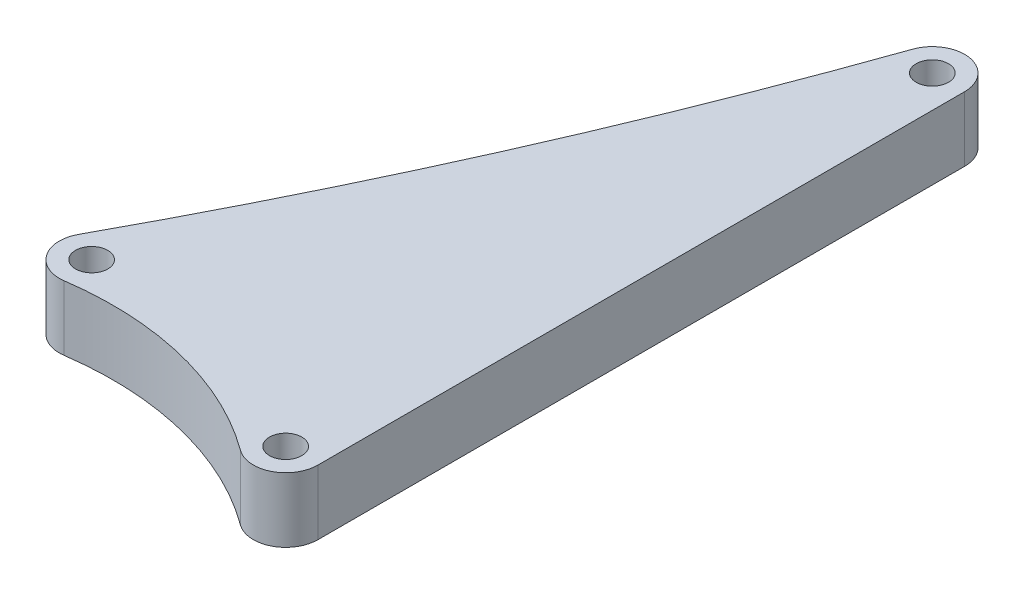
from build123d import *

# Parameters (mm, degrees)
SKETCH1_R           = 2.5
SKETCH1_R_2         = 1.25
BOSS_EXTRUDE1_DEPTH = 5


with BuildPart() as part:
    # Sketch1 → Boss-Extrude1 (new body)
    # profile 1 of 4: a face of its own
    with BuildSketch(Plane(origin=(0, 0, 0), x_dir=(1, 0, 0), z_dir=(0, 1, 0))):
        with Locations((0, -5)):
            Circle(SKETCH1_R)
        with Locations(Location((0, -5, 0), (0, 0, 270))):
            Circle(SKETCH1_R_2, mode=Mode.SUBTRACT)
    # profile 2 of 4: a face of its own
    with BuildSketch(Plane(origin=(0, 0, 0), x_dir=(1, 0, 0), z_dir=(0, 1, 0))):
        with BuildLine():
            Line((22.5, -10), (22.5, 40))
            ThreePointArc((22.5, 40), (19.579674257, 37.535588048), (17.641338984, 40.828684628))
            ThreePointArc((17.641338984, 40.828684628), (8.619996831, 18.113334742), (-2.195652157, -3.80454544))
            ThreePointArc((-2.195652157, -3.80454544), (0.616793972, -2.577281445), (2.5, -5))
            ThreePointArc((2.5, -5), (1.888934091, -6.637659305), (0.354457601, -7.474744393))
            ThreePointArc((0.354457601, -7.474744393), (9.883853248, -7.964587007), (18.522657697, -12.016794417))
            ThreePointArc((18.522657697, -12.016794417), (18.869370918, -7.770274035), (22.5, -10))
        make_face()
    # profile 3 of 4: a face of its own
    with BuildSketch(Plane(origin=(0, 0, 0), x_dir=(1, 0, 0), z_dir=(0, 1, 0))):
        with Locations((20, -10)):
            Circle(SKETCH1_R)
        with Locations(Location((20, -10, 0), (0, 0, 270))):
            Circle(SKETCH1_R_2, mode=Mode.SUBTRACT)
    # profile 4 of 4: a face of its own
    with BuildSketch(Plane(origin=(0, 0, 0), x_dir=(1, 0, 0), z_dir=(0, 1, 0))):
        with Locations((20, 40)):
            Circle(SKETCH1_R)
        with Locations(Location((20, 40, 0), (0, 0, 270))):
            Circle(SKETCH1_R_2, mode=Mode.SUBTRACT)
    extrude(amount=BOSS_EXTRUDE1_DEPTH)


solid = part.part
